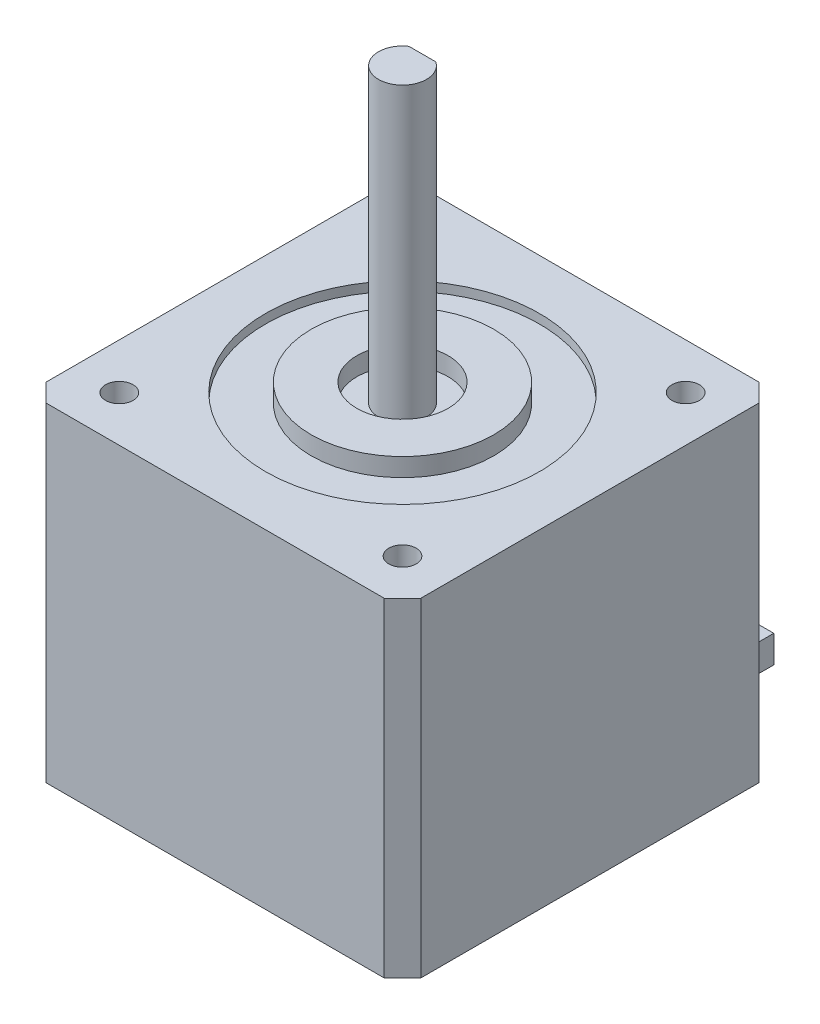
from build123d import *

# Parameters (mm, degrees)
BOSS_EXTRUDE1_DEPTH          = 36
SKETCH2_R                    = 15
CUT_EXTRUDE1_DEPTH           = 1
SKETCH3_R                    = 10
SKETCH3_R_2                  = 5
BOSS_EXTRUDE2_DEPTH          = 2
BOSS_EXTRUDE3_DEPTH          = 32
F_3_0_3_DIAMETER_HOLE1_D     = 3
F_3_0_3_DIAMETER_HOLE1_DEPTH = 5
F_3_0_3_DIAMETER_HOLE1_TIP   = 0.901290929
SKETCH7_W                    = 20
SKETCH7_H                    = 3
BOSS_EXTRUDE4_DEPTH          = 10


with BuildPart() as part:
    # Sketch1 → Boss-Extrude1 (new body)
    with BuildSketch(Plane(origin=(0, 0, 0), x_dir=(1, 0, 0), z_dir=(0, 1, 0))):
        Polygon((-20.5, 18.5), (-18.5, 20.5), (18.5, 20.5), (20.5, 18.5), (20.5, -18.5), (18.5, -20.5), (-18.5, -20.5), (-20.5, -18.5), align=None)
    extrude(amount=BOSS_EXTRUDE1_DEPTH)

    # Sketch2 → Cut-Extrude1 (cut)
    with BuildSketch(Plane(origin=(0, 36, 0), x_dir=(-1, 0, 0), z_dir=(0, 1, 0))):
        Circle(SKETCH2_R)
    extrude(amount=-CUT_EXTRUDE1_DEPTH, mode=Mode.SUBTRACT)

    # Sketch3 → Boss-Extrude2 (add)
    with BuildSketch(Plane(origin=(0, 35, 0), x_dir=(1, 0, 0), z_dir=(0, 1, 0))):
        Circle(SKETCH3_R)
        Circle(SKETCH3_R_2, mode=Mode.SUBTRACT)
    extrude(amount=BOSS_EXTRUDE2_DEPTH)

    # Sketch4 → Boss-Extrude3 (add)
    with BuildSketch(Plane(origin=(0, 35, 0), x_dir=(1, 0, 0), z_dir=(0, 1, 0))):
        with BuildLine():
            Line((-1.470984161, 2.175359116), (1.470984161, 2.175359116))
            ThreePointArc((1.470984161, 2.175359116), (0, -2.626020123), (-1.470984161, 2.175359116))
        make_face()
    extrude(amount=BOSS_EXTRUDE3_DEPTH)

    # Ø3.0 (3) Diameter Hole1
    with Locations(Plane(origin=(0, 36, 0), x_dir=(-1, 0, 0), z_dir=(0, 1, 0))):
        with Locations((-15.5, -15.5), (15.5, -15.5), (15.5, 15.5), (-15.5, 15.5)):
            Hole(F_3_0_3_DIAMETER_HOLE1_D / 2, depth=F_3_0_3_DIAMETER_HOLE1_DEPTH)
            with Locations((0, 0, -(F_3_0_3_DIAMETER_HOLE1_DEPTH + F_3_0_3_DIAMETER_HOLE1_TIP / 2))):  # 118° drill point
                Cone(0, F_3_0_3_DIAMETER_HOLE1_D / 2, F_3_0_3_DIAMETER_HOLE1_TIP, mode=Mode.SUBTRACT)

    # Sketch7 → Boss-Extrude4 (add)
    with BuildSketch(Plane(origin=(0, 0, -20.5), x_dir=(-1, 0, 0), z_dir=(0, 0, -1))):
        with Locations((-0.141546157, 1.5)):
            Rectangle(SKETCH7_W, SKETCH7_H)
    extrude(amount=BOSS_EXTRUDE4_DEPTH)


solid = part.part
